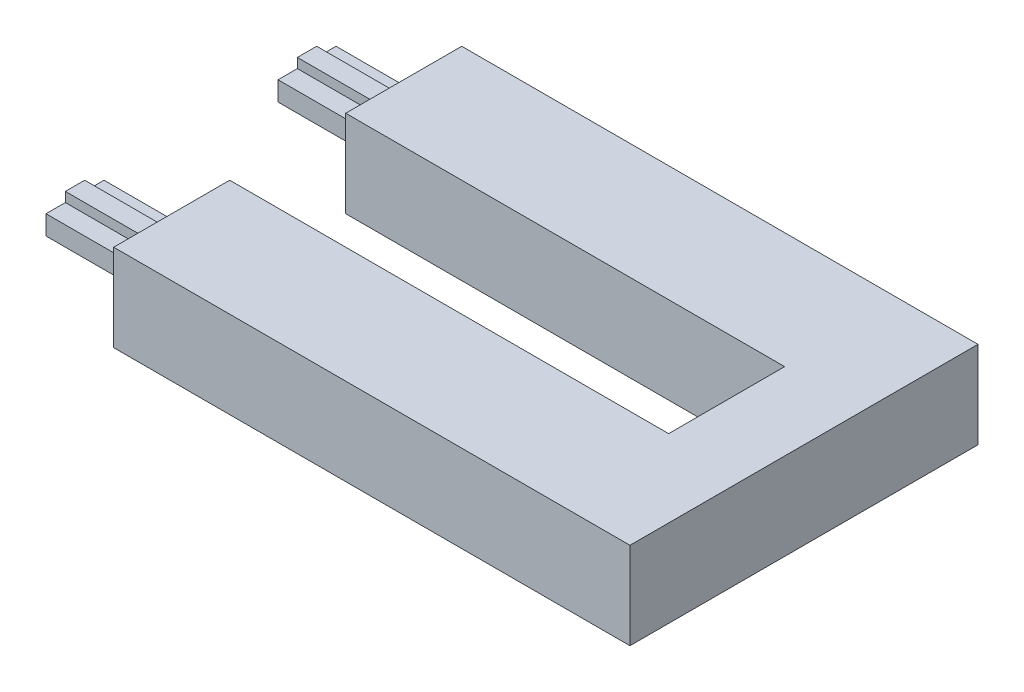
from build123d import *

# Parameters (mm, degrees)
BOSS_EXTRUDE1_DEPTH = 4.5
SKETCH3_W           = 3
SKETCH3_H           = 1
SKETCH3_W_2         = 1
SKETCH3_H_2         = 2
EXTRUDE_THIN1_DEPTH = 5


with BuildPart() as part:
    # Sketch1 → Boss-Extrude1 (new body)
    with BuildSketch(Plane(origin=(0, 0, 0), x_dir=(1, 0, 0), z_dir=(0, 1, 0))):
        Polygon((0, 12), (0, 18), (26.7, 18), (26.7, 0), (0, 0), (0, 6), (22.7, 6), (22.7, 12), align=None)
    extrude(amount=BOSS_EXTRUDE1_DEPTH)

    # Sketch3 → Extrude-Thin1 (add)
    with BuildSketch(Plane.ZY):
        with Locations((-15, 2.25)):
            Rectangle(SKETCH3_W, SKETCH3_H)
        with Locations((-15, 2.25)):
            Rectangle(SKETCH3_W_2, SKETCH3_H_2)
        with Locations((-3, 2.25)):
            Rectangle(SKETCH3_W_2, SKETCH3_H_2)
        with Locations((-3, 2.25)):
            Rectangle(SKETCH3_W, SKETCH3_H)
    extrude(amount=EXTRUDE_THIN1_DEPTH)


solid = part.part
